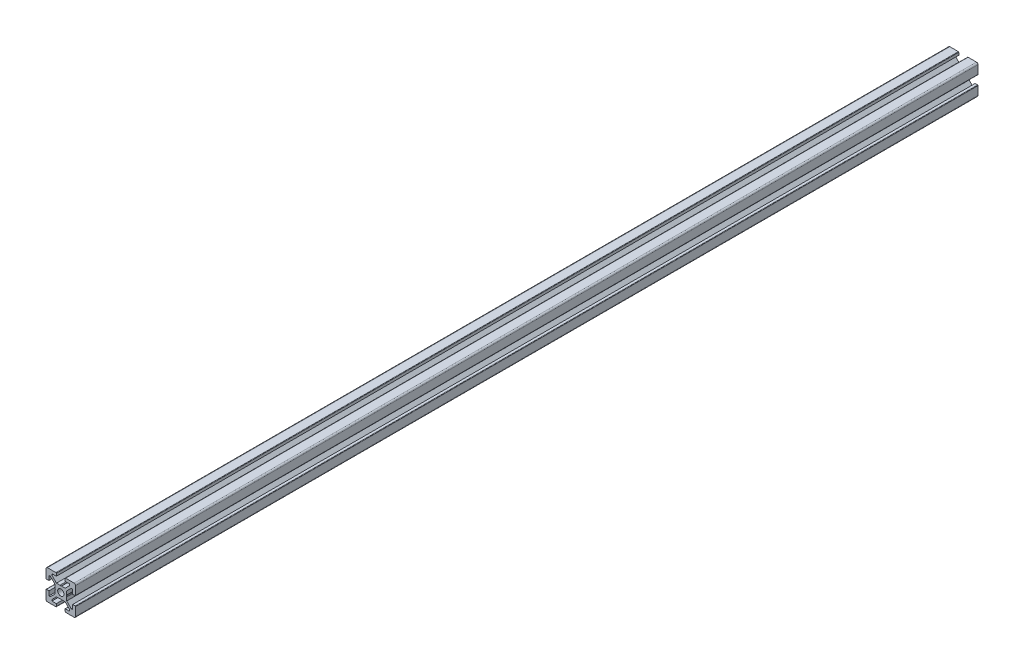
from build123d import *

# Parameters (mm, degrees)
BOSS_EXTRUDE1_DEPTH = 609.5
SKETCH2_W           = 609.5
SKETCH2_H           = 2.1


with BuildPart() as part:
    # Sketch1 → Boss-Extrude1 (new body)
    with BuildSketch(Plane.XY):
        with BuildLine():
            Line((-10, 9), (-10, 3.29999995))
            ThreePointArc((-10, 3.29999995), (-9.912132049, 3.087867916), (-9.7, 3))
            Line((-9.7, 3), (-8, 3))
            Line((-8, 3), (-8, 6))
            Line((-8, 6), (-7.060677, 6))
            Line((-7.060677, 6), (-4, 2.93932965))
            Line((-4, 2.93932965), (-4, 0.519615242))
            Line((-4, 0.519615242), (-3.699996283, -6.437e-06))
            Line((-3.699996283, -6.437e-06), (-4, -0.519628117))
            Line((-4, -0.519628117), (-4, -2.93933725))
            Line((-4, -2.93933725), (-7.0606695, -6))
            Line((-7.0606695, -6), (-8, -6))
            Line((-8, -6), (-8, -3))
            Line((-8, -3), (-9.7, -3))
            ThreePointArc((-9.7, -3), (-9.912132049, -3.087867916), (-10, -3.29999995))
            Line((-10, -3.29999995), (-10, -9))
            ThreePointArc((-10, -9), (-9.707106781, -9.707106781), (-9, -10))
            Line((-9, -10), (-3.29999995, -10))
            ThreePointArc((-3.29999995, -10), (-3.087867916, -9.912132049), (-3, -9.7))
            Line((-3, -9.7), (-3, -8))
            Line((-3, -8), (-6, -8))
            Line((-6, -8), (-6, -7.0606515))
            Line((-6, -7.0606515), (-2.9393489, -4))
            Line((-2.9393489, -4), (-0.519615242, -4))
            Line((-0.519615242, -4), (6.437e-06, -3.699996283))
            Line((6.437e-06, -3.699996283), (0.519628117, -4))
            Line((0.519628117, -4), (2.9393227, -4))
            Line((2.9393227, -4), (6, -7.060677))
            Line((6, -7.060677), (6, -8))
            Line((6, -8), (3, -8))
            Line((3, -8), (3, -9.7))
            ThreePointArc((3, -9.7), (3.087867916, -9.912132049), (3.29999995, -10))
            Line((3.29999995, -10), (9, -10))
            ThreePointArc((9, -10), (9.707106781, -9.707106781), (10, -9))
            Line((10, -9), (10, -3.29999995))
            ThreePointArc((10, -3.29999995), (9.912132049, -3.087867916), (9.7, -3))
            Line((9.7, -3), (8, -3))
            Line((8, -3), (8, -6))
            Line((8, -6), (7.0606435, -6))
            Line((7.0606435, -6), (4, -2.9393482))
            Line((4, -2.9393482), (4, -0.519615242))
            Line((4, -0.519615242), (3.699996283, 6.437e-06))
            Line((3.699996283, 6.437e-06), (4, 0.519628117))
            Line((4, 0.519628117), (4, 2.9393401))
            Line((4, 2.9393401), (7.060651, 6))
            Line((7.060651, 6), (8, 6))
            Line((8, 6), (8, 3))
            Line((8, 3), (9.7, 3))
            ThreePointArc((9.7, 3), (9.912132049, 3.087867916), (10, 3.29999995))
            Line((10, 3.29999995), (10, 9))
            ThreePointArc((10, 9), (9.707106781, 9.707106781), (9, 10))
            Line((9, 10), (3.29999995, 10))
            ThreePointArc((3.29999995, 10), (3.087867916, 9.912132049), (3, 9.7))
            Line((3, 9.7), (3, 8))
            Line((3, 8), (6, 8))
            Line((6, 8), (6, 7.060669))
            Line((6, 7.060669), (2.9393308, 4))
            Line((2.9393308, 4), (0.519615242, 4))
            Line((0.519615242, 4), (-6.437e-06, 3.699996283))
            Line((-6.437e-06, 3.699996283), (-0.519628117, 4))
            Line((-0.519628117, 4), (-2.93935655, 4))
            Line((-2.93935655, 4), (-6, 7.0606435))
            Line((-6, 7.0606435), (-6, 8))
            Line((-6, 8), (-3, 8))
            Line((-3, 8), (-3, 9.7))
            ThreePointArc((-3, 9.7), (-3.087867966, 9.912132034), (-3.3, 10))
            Line((-3.3, 10), (-9, 10))
            ThreePointArc((-9, 10), (-9.707106781, 9.707106781), (-10, 9))
        make_face()
    extrude(amount=-BOSS_EXTRUDE1_DEPTH)

    # Sketch2 → Cut-Revolve1 (revolve, cut)
    with BuildSketch(Plane(origin=(0, 0, 0), x_dir=(0, 0, -1), z_dir=(1, 0, 0)), mode=Mode.PRIVATE) as cut_revolve1_sk:
        with Locations((304.75, 1.05)):
            Rectangle(SKETCH2_W, SKETCH2_H)
    revolve(cut_revolve1_sk.sketch.rotate(Axis((0, 0, -609.5), (0, 0, 1)), 270), axis=Axis((0, 0, -609.5), (0, 0, 1)), mode=Mode.SUBTRACT)


solid = part.part
